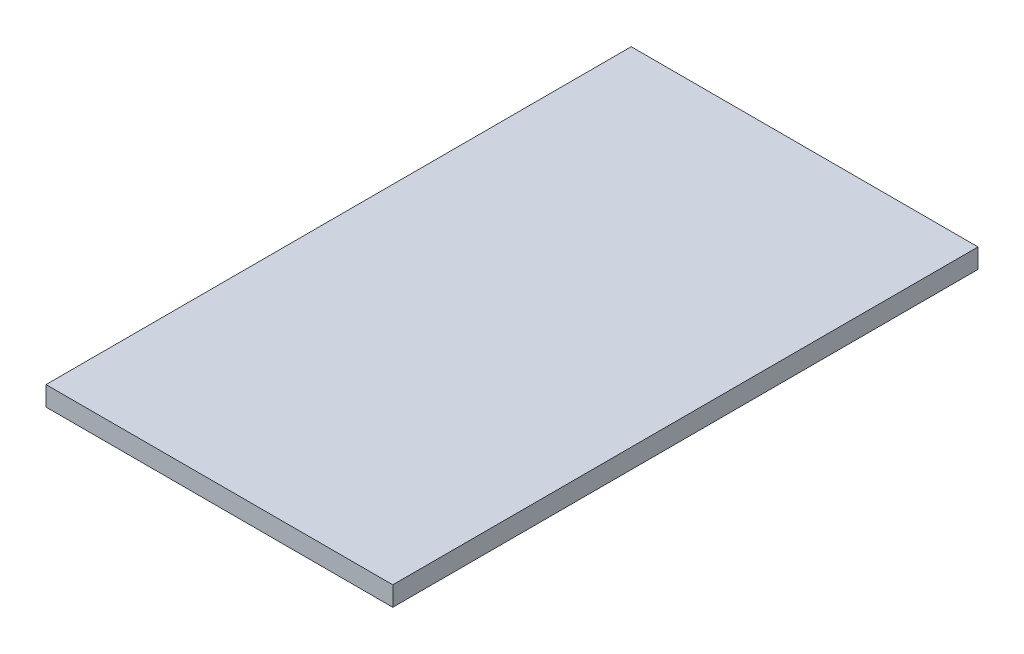
from build123d import *

# Parameters (mm, degrees)
SKETCH1_W           = 160
SKETCH1_H           = 270
BOSS_EXTRUDE1_DEPTH = 4.5


with BuildPart() as part:
    # Sketch1 → Boss-Extrude1 (new, symmetric)
    with BuildSketch(Plane(origin=(0, 0, 0), x_dir=(1, 0, 0), z_dir=(0, 1, 0))):
        Rectangle(SKETCH1_W, SKETCH1_H)
    extrude(amount=BOSS_EXTRUDE1_DEPTH, both=True)


solid = part.part
